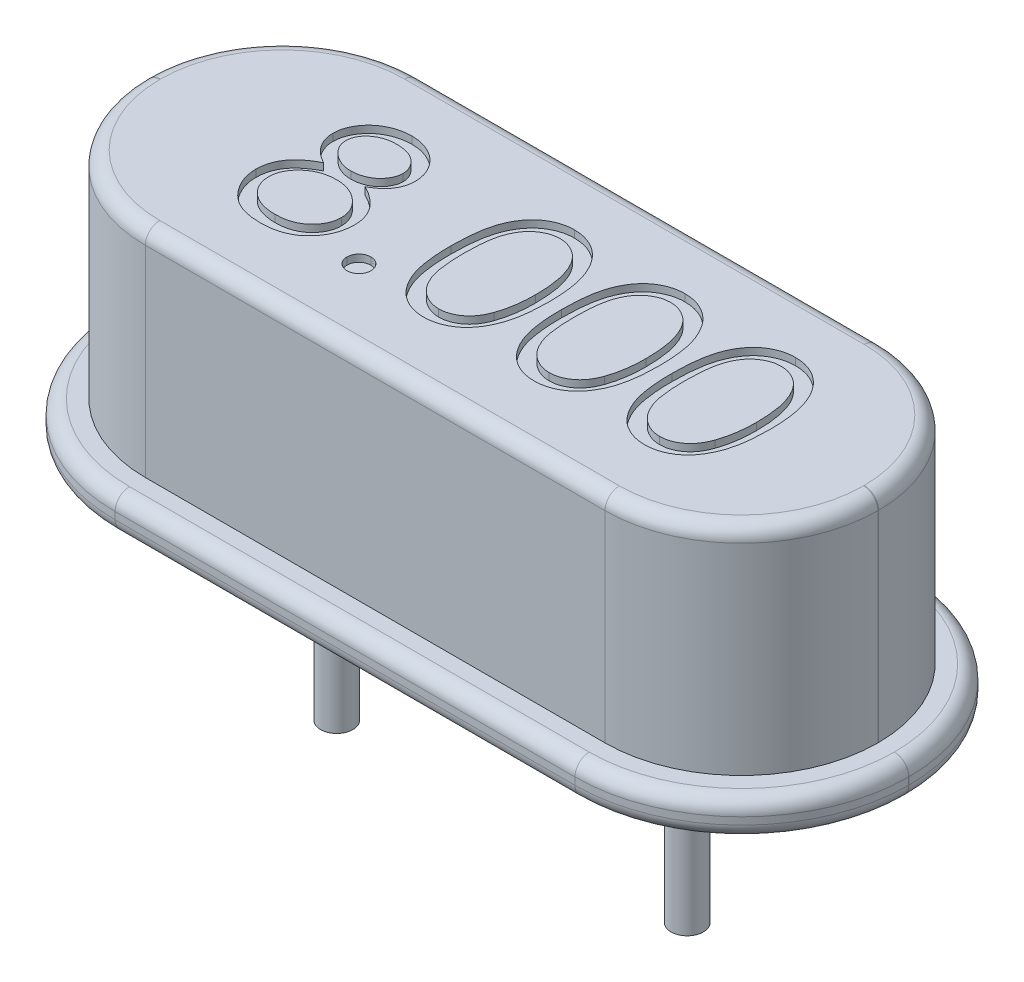
from build123d import *

# Parameters (mm, degrees)
BOSS_EXTRUDE1_DEPTH = 0.5
BOSS_EXTRUDE2_DEPTH = 3
FILLET1_R           = 0.2
SKETCH3_R           = 0.225
BOSS_EXTRUDE3_DEPTH = 3
CUT_EXTRUDE1_DEPTH  = 0.1


with BuildPart() as part:
    # Sketch1 → Boss-Extrude1 (new body)
    with BuildSketch(Plane(origin=(0, 0, 0), x_dir=(1, 0, 0), z_dir=(0, 1, 0))):
        with BuildLine():
            Line((-3.201, -2.325), (3.201, -2.325))
            ThreePointArc((3.201, -2.325), (4.844316159, -1.644316159), (5.525, -0.001))
            Line((5.525, -0.001), (5.525, 0.001))
            ThreePointArc((5.525, 0.001), (4.844316159, 1.644316159), (3.201, 2.325))
            Line((3.201, 2.325), (-3.201, 2.325))
            ThreePointArc((-3.201, 2.325), (-4.844316159, 1.644316159), (-5.525, 0.001))
            Line((-5.525, 0.001), (-5.525, -0.001))
            ThreePointArc((-5.525, -0.001), (-4.844316159, -1.644316159), (-3.201, -2.325))
        make_face()
    extrude(amount=BOSS_EXTRUDE1_DEPTH)

    # Sketch2 → Boss-Extrude2 (add)
    with BuildSketch(Plane(origin=(0, 0.5, 0), x_dir=(1, 0, 0), z_dir=(0, 1, 0))):
        with BuildLine():
            Line((-3.2, -1.905), (3.2, -1.905))
            ThreePointArc((3.2, -1.905), (4.543502884, -1.348502884), (5.1, -0.005))
            Line((5.1, -0.005), (5.1, 0.005))
            ThreePointArc((5.1, 0.005), (4.543502884, 1.348502884), (3.2, 1.905))
            Line((3.2, 1.905), (-3.2, 1.905))
            ThreePointArc((-3.2, 1.905), (-4.543502884, 1.348502884), (-5.1, 0.005))
            Line((-5.1, 0.005), (-5.1, -0.005))
            ThreePointArc((-5.1, -0.005), (-4.543502884, -1.348502884), (-3.2, -1.905))
        make_face()
    extrude(amount=BOSS_EXTRUDE2_DEPTH)

    # Fillet1
    fillet1_edges = [part.edges().sort_by_distance(p)[0] for p in [
        (-4.844316159, 0.5, -1.644316159),
        (0, 0, -2.325),
        (4.844316159, 0, -1.644316159),
        (-5.525, 0.5, 0),
        (-4.844316159, 0.5, 1.644316159),
        (0, 0.5, 2.325),
        (4.844316159, 0.5, 1.644316159),
        (5.525, 0.5, 0),
        (4.543502884, 3.5, -1.348502884),
        (0, 3.5, -1.905),
        (-4.543502884, 3.5, -1.348502884),
        (-5.1, 3.5, 0),
        (-4.543502884, 3.5, 1.348502884),
        (0, 3.5, 1.905),
        (4.543502884, 3.5, 1.348502884),
        (5.1, 3.5, 0),
        (4.844316159, 0.5, -1.644316159),
        (0, 0.5, -2.325),
        (5.525, 0, 0),
        (4.844316159, 0, 1.644316159),
        (0, 0, 2.325),
        (-4.844316159, 0, 1.644316159),
        (-5.525, 0, 0),
        (-4.844316159, 0, -1.644316159),
    ]]
    fillet(fillet1_edges, radius=FILLET1_R)

    # Sketch3 → Boss-Extrude3 (add)
    with BuildSketch(Plane.XZ):
        with Locations(Location((-2.44, 0, 0), (0, 0, 270))):
            Circle(SKETCH3_R)
        with Locations(Location((2.44, 0, 0), (0, 0, 270))):
            Circle(SKETCH3_R)
    extrude(amount=BOSS_EXTRUDE3_DEPTH)

    # Sketch4 → Cut-Extrude1 (cut)
    # profile 1 of 5: a face of its own
    with BuildSketch(Plane(origin=(0, 3.5, 0), x_dir=(1, 0, 0), z_dir=(0, 1, 0))):
        with BuildLine():
            add(Edge.make_bspline(
                [(-2.17690029, 0.131910274), (-2.160529692, 0.123374299), (-2.128601558, 0.106726297), (-2.083128867, 0.07992011), (-2.041571724, 0.05166813), (-2.002777117, 0.023304782), (-1.967426631, -0.006256162), (-1.935915538, -0.037132251), (-1.907465469, -0.068552791), (-1.882650164, -0.101049843), (-1.8608234, -0.134537071), (-1.841959323, -0.16910237), (-1.825835207, -0.204669989), (-1.813056385, -0.241628178), (-1.802529647, -0.279434041), (-1.795286444, -0.318575745), (-1.791391063, -0.358795369), (-1.790654598, -0.385977255), (-1.790281701, -0.399740367)],
                knots=[0, 0, 0, 0, 1.272397273, 2.481599622, 3.635517121, 4.734568067, 5.792894095, 6.808321871, 7.773003508, 8.711915296, 9.623354172, 10.525449501, 11.423591555, 12.311487226, 13.218079475, 14.126165749, 15.051214107, 16, 16, 16, 16], degree=3))
            add(Edge.make_bspline(
                [(-1.790281701, -0.399740367), (-1.790722512, -0.418996215), (-1.791595044, -0.457110761), (-1.799195035, -0.513365682), (-1.81057388, -0.568000986), (-1.827190744, -0.621004695), (-1.848741253, -0.672084337), (-1.875299445, -0.721283636), (-1.905362991, -0.769408956), (-1.929507128, -0.799020042), (-1.941724008, -0.814003188)],
                knots=[0, 0, 0, 0, 1.025265484, 2.029385089, 3.018602448, 3.995076438, 4.983346944, 5.966715145, 6.97116228, 8, 8, 8, 8], degree=3))
            add(Edge.make_bspline(
                [(-1.941724008, -0.814003188), (-1.957630565, -0.831485345), (-1.989247117, -0.866233626), (-2.04340879, -0.911348375), (-2.102849866, -0.949262314), (-2.167340342, -0.98016054), (-2.236707828, -1.004209602), (-2.310937545, -1.021491041), (-2.390174204, -1.031389572), (-2.444634473, -1.032820423), (-2.472573367, -1.03355447)],
                knots=[0, 0, 0, 0, 0.954267603, 1.896743057, 2.838368354, 3.796610408, 4.779680527, 5.799409237, 6.871065594, 8, 8, 8, 8], degree=3))
            add(Edge.make_bspline(
                [(-2.472573367, -1.03355447), (-2.499438161, -1.032895911), (-2.55171432, -1.031614423), (-2.627804536, -1.02293189), (-2.698732004, -1.007715966), (-2.764909129, -0.986890475), (-2.825936954, -0.959798916), (-2.881641583, -0.926079826), (-2.93282671, -0.88709043), (-2.977938981, -0.841710957), (-3.01798952, -0.793106458), (-3.053171265, -0.742962681), (-3.082413595, -0.691275048), (-3.107171935, -0.638814267), (-3.126125091, -0.584845036), (-3.139252069, -0.529645029), (-3.14758882, -0.473310661), (-3.148698039, -0.435292574), (-3.14925606, -0.416166649)],
                knots=[0, 0, 0, 0, 1.256902934, 2.445805442, 3.576955095, 4.645999104, 5.686449165, 6.692658513, 7.68621702, 8.689161843, 9.678783111, 10.630372946, 11.551080876, 12.453998257, 13.34127905, 14.221779781, 15.105423033, 16, 16, 16, 16], degree=3))
            add(Edge.make_bspline(
                [(-3.14925606, -0.416166649), (-3.148925842, -0.402132825), (-3.148273215, -0.374397036), (-3.143756159, -0.333420277), (-3.136494181, -0.293536771), (-3.126631634, -0.254599203), (-3.113265333, -0.216891048), (-3.097126972, -0.180233634), (-3.078308713, -0.144585578), (-3.056548047, -0.109751931), (-3.031232605, -0.076220781), (-3.002567662, -0.04342307), (-2.969980309, -0.011867718), (-2.933833075, 0.018830811), (-2.894539053, 0.049217082), (-2.851077607, 0.077648927), (-2.804600882, 0.106139192), (-2.771569222, 0.123172521), (-2.754624649, 0.131910274)],
                knots=[0, 0, 0, 0, 0.941657376, 1.861047343, 2.762797495, 3.66048619, 4.553285746, 5.444104102, 6.34607688, 7.256116206, 8.197091036, 9.162375105, 10.176350973, 11.237807142, 12.343728897, 13.50695164, 14.721116704, 16, 16, 16, 16], degree=3))
            add(Edge.make_bspline(
                [(-2.754624649, 0.131910274), (-2.777819721, 0.144558713), (-2.822731871, 0.169049631), (-2.882200123, 0.214047806), (-2.933280479, 0.262783701), (-2.974568889, 0.31628644), (-3.007067305, 0.372884654), (-3.029363651, 0.432224227), (-3.044447356, 0.493204863), (-3.045941543, 0.534865547), (-3.046691957, 0.555788479)],
                knots=[0, 0, 0, 0, 1.166880483, 2.259407225, 3.286803203, 4.280235371, 5.237608625, 6.161067461, 7.076446754, 8, 8, 8, 8], degree=3))
            add(Edge.make_bspline(
                [(-3.046691957, 0.555788479), (-3.045757429, 0.577101369), (-3.043878865, 0.619943996), (-3.028688396, 0.683718924), (-3.003934072, 0.746356961), (-2.970264931, 0.807554511), (-2.928329379, 0.865240348), (-2.878017067, 0.916978032), (-2.820529469, 0.962298879), (-2.756153545, 1.000342406), (-2.686875696, 1.031304497), (-2.613780996, 1.052663595), (-2.538143, 1.066627091), (-2.486658589, 1.068208036), (-2.460554136, 1.069009633)],
                knots=[0, 0, 0, 0, 0.888701115, 1.786444228, 2.72001202, 3.692817113, 4.693886446, 5.687152267, 6.695133018, 7.739871481, 8.800368666, 9.853104506, 10.91144658, 12, 12, 12, 12], degree=3))
            add(Edge.make_bspline(
                [(-2.460554136, 1.069009633), (-2.435123385, 1.068183151), (-2.38497684, 1.066553423), (-2.311265625, 1.052960921), (-2.240737123, 1.030258338), (-2.173634552, 0.999459925), (-2.1111592, 0.96152453), (-2.05595788, 0.915581174), (-2.007196405, 0.864071716), (-1.966862465, 0.806403371), (-1.933626528, 0.745440975), (-1.910483156, 0.681656677), (-1.895653457, 0.616428644), (-1.893782963, 0.572292642), (-1.892845803, 0.550179504)],
                knots=[0, 0, 0, 0, 1.072916533, 2.115669174, 3.151510826, 4.193348718, 5.225979165, 6.227137561, 7.216255879, 8.211077061, 9.189680878, 10.138522389, 11.067357538, 12, 12, 12, 12], degree=3))
            add(Edge.make_bspline(
                [(-1.892845803, 0.550179504), (-1.893665552, 0.528478554), (-1.895275492, 0.48585912), (-1.908818315, 0.423729679), (-1.931625923, 0.365545657), (-1.962765444, 0.310646827), (-2.003351437, 0.260028829), (-2.052842142, 0.213047989), (-2.110842987, 0.169318373), (-2.154420636, 0.14464045), (-2.17690029, 0.131910274)],
                knots=[0, 0, 0, 0, 0.975232327, 1.915300861, 2.843280834, 3.77672583, 4.742871857, 5.749627742, 6.839139064, 8, 8, 8, 8], degree=3))
        make_face()
        with BuildLine():
            add(Edge.make_bspline(
                [(-2.470570162, 0.863881428), (-2.484599194, 0.863509176), (-2.512046115, 0.862780889), (-2.55229107, 0.858975953), (-2.590560994, 0.851574115), (-2.627255737, 0.841723423), (-2.661872201, 0.828416001), (-2.694880518, 0.81276171), (-2.725718912, 0.793729672), (-2.754759657, 0.772380416), (-2.780902957, 0.748898756), (-2.804105557, 0.724433774), (-2.823378766, 0.698504978), (-2.839745114, 0.671757344), (-2.851620267, 0.643397015), (-2.860514155, 0.614293485), (-2.866526378, 0.58407898), (-2.866976887, 0.563429546), (-2.867204778, 0.552983992)],
                knots=[0, 0, 0, 0, 1.203892937, 2.355340988, 3.463153438, 4.544400666, 5.610487187, 6.640501085, 7.674077295, 8.714426146, 9.728707835, 10.68524104, 11.601827946, 12.495867327, 13.368432065, 14.231010473, 15.105153427, 16, 16, 16, 16], degree=3))
            add(Edge.make_bspline(
                [(-2.867204778, 0.552983992), (-2.866811996, 0.542537986), (-2.866035805, 0.521895179), (-2.860032874, 0.491411827), (-2.8510861, 0.461456606), (-2.837000008, 0.432741799), (-2.820104946, 0.404271308), (-2.799252674, 0.376756688), (-2.774401801, 0.350102182), (-2.746386121, 0.324534502), (-2.715865242, 0.300592351), (-2.683531503, 0.279807676), (-2.649790708, 0.262416756), (-2.614989525, 0.24794281), (-2.57877327, 0.236691417), (-2.541363856, 0.228709334), (-2.502754998, 0.223748193), (-2.476594666, 0.223155609), (-2.463358624, 0.222855786)],
                knots=[0, 0, 0, 0, 0.873023192, 1.725219244, 2.590779336, 3.480155217, 4.391973325, 5.357036234, 6.360879153, 7.436073238, 8.526419356, 9.601555421, 10.645666583, 11.697338044, 12.750135903, 13.812665442, 14.89329948, 16, 16, 16, 16], degree=3))
            add(Edge.make_bspline(
                [(-2.463358624, 0.222855786), (-2.446358564, 0.223354568), (-2.412526354, 0.224347204), (-2.362652451, 0.233576446), (-2.314159511, 0.248094113), (-2.267565851, 0.267956951), (-2.224077517, 0.292887157), (-2.185311763, 0.322734596), (-2.151599253, 0.35681008), (-2.123290333, 0.394583129), (-2.101341849, 0.434784036), (-2.084255102, 0.475127061), (-2.074277265, 0.516042621), (-2.072975798, 0.543452315), (-2.072332983, 0.556990402)],
                knots=[0, 0, 0, 0, 1.076279235, 2.141928126, 3.20205304, 4.278698113, 5.344010996, 6.36967002, 7.368914609, 8.37248503, 9.349703398, 10.264243087, 11.142681841, 12, 12, 12, 12], degree=3))
            add(Edge.make_bspline(
                [(-2.072332983, 0.556990402), (-2.072636924, 0.566492137), (-2.073240204, 0.585351718), (-2.078211665, 0.613202213), (-2.086426427, 0.640419118), (-2.097548187, 0.667227272), (-2.112182355, 0.693250548), (-2.129533319, 0.718898027), (-2.150610177, 0.743592749), (-2.174265282, 0.767910205), (-2.20109123, 0.790415362), (-2.231036323, 0.810206625), (-2.263947037, 0.827013685), (-2.299824151, 0.840664402), (-2.338535537, 0.850917174), (-2.379902893, 0.858595087), (-2.424271149, 0.862922579), (-2.454802435, 0.863554879), (-2.470570162, 0.863881428)],
                knots=[0, 0, 0, 0, 0.814439003, 1.616544685, 2.417341072, 3.248991801, 4.09997495, 4.973547432, 5.9003056, 6.880240646, 7.880314356, 8.896779544, 9.951930927, 11.043077905, 12.18215768, 13.381699519, 14.647792085, 16, 16, 16, 16], degree=3))
        make_face(mode=Mode.SUBTRACT)
        with BuildLine():
            add(Edge.make_bspline(
                [(-2.458951572, 0.017727581), (-2.476737736, 0.017411215), (-2.511629848, 0.016790581), (-2.562748092, 0.009882295), (-2.611807044, 0.000265499), (-2.658641294, -0.014323552), (-2.703231063, -0.033292975), (-2.745817739, -0.056112712), (-2.786075527, -0.083087251), (-2.823448514, -0.113873888), (-2.857576131, -0.147050719), (-2.887518016, -0.182171939), (-2.912945171, -0.218584815), (-2.933421314, -0.256751803), (-2.950228018, -0.295864724), (-2.96126452, -0.336897635), (-2.968339783, -0.3790617), (-2.969289858, -0.407724613), (-2.96976888, -0.422176265)],
                knots=[0, 0, 0, 0, 1.140299081, 2.23698856, 3.303958914, 4.344563908, 5.37730929, 6.408454204, 7.439741482, 8.480804886, 9.510774543, 10.48932336, 11.43758569, 12.353841022, 13.263987381, 14.161954604, 15.073269652, 16, 16, 16, 16], degree=3))
            add(Edge.make_bspline(
                [(-2.96976888, -0.422176265), (-2.968989875, -0.440136783), (-2.967444347, -0.47577003), (-2.955183411, -0.528434642), (-2.935505962, -0.579418102), (-2.908062981, -0.628304932), (-2.874081511, -0.673990707), (-2.832294958, -0.713812865), (-2.785300194, -0.749196567), (-2.731507134, -0.777814015), (-2.672748011, -0.800668218), (-2.609038452, -0.816414482), (-2.541292784, -0.826838168), (-2.494515874, -0.827888557), (-2.470570162, -0.828426265)],
                knots=[0, 0, 0, 0, 0.898778495, 1.783155532, 2.693654817, 3.627872908, 4.583023416, 5.533784346, 6.509005473, 7.520592997, 8.575161974, 9.658835044, 10.801527049, 12, 12, 12, 12], degree=3))
            add(Edge.make_bspline(
                [(-2.470570162, -0.828426265), (-2.451855666, -0.828066946), (-2.415393827, -0.827366877), (-2.362201856, -0.82118728), (-2.312004971, -0.811387495), (-2.264900515, -0.79713404), (-2.220361178, -0.779734053), (-2.179142118, -0.757350007), (-2.14018296, -0.731891536), (-2.105403461, -0.701686875), (-2.073727342, -0.669412878), (-2.046108318, -0.63524714), (-2.022132574, -0.600118207), (-2.003314885, -0.563232216), (-1.988271312, -0.525296836), (-1.977457852, -0.485962258), (-1.970785729, -0.445107839), (-1.970110931, -0.417394084), (-1.96976888, -0.403346137)],
                knots=[0, 0, 0, 0, 1.224942928, 2.386581632, 3.501229538, 4.569074225, 5.605009692, 6.626002462, 7.634866581, 8.645888296, 9.63523824, 10.59253846, 11.518950513, 12.414518923, 13.29783783, 14.186679152, 15.080837789, 16, 16, 16, 16], degree=3))
            add(Edge.make_bspline(
                [(-1.96976888, -0.403346137), (-1.970286508, -0.389701942), (-1.971307179, -0.362797974), (-1.977785289, -0.322931387), (-1.98916579, -0.284415493), (-2.004781445, -0.246786918), (-2.025570567, -0.210808089), (-2.05005335, -0.175541706), (-2.079592846, -0.141966594), (-2.112971472, -0.109821968), (-2.149348021, -0.08009869), (-2.188014961, -0.053804725), (-2.228674654, -0.031660659), (-2.27124106, -0.013651233), (-2.315619663, 0.000513036), (-2.361777823, 0.01040789), (-2.40976958, 0.016636234), (-2.442372363, 0.017359689), (-2.458951572, 0.017727581)],
                knots=[0, 0, 0, 0, 0.917430815, 1.809013306, 2.70690318, 3.612392954, 4.541220862, 5.495268465, 6.494511384, 7.542276156, 8.608045339, 9.649016899, 10.681629292, 11.715607085, 12.752076957, 13.808767841, 14.885711793, 16, 16, 16, 16], degree=3))
        make_face(mode=Mode.SUBTRACT)
    # profile 2 of 5: a face of its own
    with BuildSketch(Plane(origin=(0, 3.5, 0), x_dir=(1, 0, 0), z_dir=(0, 1, 0))):
        with BuildLine():
            add(Edge.make_bspline(
                [(-1.290281701, -0.674580111), (-1.279144436, -0.67524192), (-1.257311132, -0.676539321), (-1.225745916, -0.685440277), (-1.197177539, -0.701245226), (-1.171730542, -0.722309671), (-1.150755413, -0.74785005), (-1.134387211, -0.776190569), (-1.125563791, -0.80802005), (-1.124275842, -0.829979865), (-1.123615034, -0.841246778)],
                knots=[0, 0, 0, 0, 1.020151414, 1.999887582, 2.974338812, 3.990962822, 5.007586832, 5.987933904, 6.967670073, 8, 8, 8, 8], degree=3))
            add(Edge.make_bspline(
                [(-1.123615034, -0.841246778), (-1.124298234, -0.852242966), (-1.125645496, -0.873927288), (-1.134366986, -0.905516695), (-1.150880157, -0.933874927), (-1.171585868, -0.959761863), (-1.19718383, -0.980870931), (-1.225813456, -0.996541414), (-1.257237032, -1.006079688), (-1.279132074, -1.007294715), (-1.290281701, -1.007913444)],
                knots=[0, 0, 0, 0, 1.009421747, 1.99056486, 2.972319754, 3.999869655, 5.017953583, 5.993804169, 6.978383603, 8, 8, 8, 8], degree=3))
            add(Edge.make_bspline(
                [(-1.290281701, -1.007913444), (-1.301439361, -1.007317103), (-1.323222037, -1.006152889), (-1.354528319, -0.996345571), (-1.383332301, -0.981017879), (-1.408925279, -0.959722502), (-1.429804406, -0.934008135), (-1.445590339, -0.905321394), (-1.455070424, -0.874017715), (-1.456317209, -0.852260777), (-1.456948367, -0.841246778)],
                knots=[0, 0, 0, 0, 1.022052826, 1.995314843, 2.982371812, 4.00089066, 5.028879526, 6.005146991, 6.990147033, 8, 8, 8, 8], degree=3))
            add(Edge.make_bspline(
                [(-1.456948367, -0.841246778), (-1.456341453, -0.829961418), (-1.455156529, -0.807928138), (-1.445570437, -0.776385791), (-1.429926887, -0.747718111), (-1.408780947, -0.722348637), (-1.383338493, -0.70109875), (-1.354597804, -0.685633153), (-1.323146638, -0.676467204), (-1.301426673, -0.675220051), (-1.290281701, -0.674580111)],
                knots=[0, 0, 0, 0, 1.032775665, 2.016367738, 2.991239715, 4.008302682, 5.025365648, 6.011011707, 6.979408107, 8, 8, 8, 8], degree=3))
        make_face()
    # profile 3 of 5: a face of its own
    with BuildSketch(Plane(origin=(0, 3.5, 0), x_dir=(1, 0, 0), z_dir=(0, 1, 0))):
        with BuildLine():
            add(Edge.make_bspline(
                [(-0.867204778, 0.016926299), (-0.867017339, 0.048981949), (-0.866653236, 0.111250512), (-0.862602709, 0.201984593), (-0.855873942, 0.287104758), (-0.846652587, 0.366615082), (-0.835430884, 0.44053609), (-0.820450605, 0.508670237), (-0.803414718, 0.571332869), (-0.783670464, 0.628728325), (-0.761391727, 0.68162987), (-0.737143578, 0.731015699), (-0.709963695, 0.776811089), (-0.681405459, 0.81974697), (-0.650312847, 0.859120509), (-0.617570681, 0.895487745), (-0.581901038, 0.928008174), (-0.544516461, 0.957634632), (-0.505078482, 0.983605759), (-0.464711244, 1.00648161), (-0.423136898, 1.026024391), (-0.380241936, 1.041390354), (-0.336411903, 1.054082267), (-0.291493579, 1.062761666), (-0.2454128, 1.068222756), (-0.214309123, 1.068744852), (-0.198534906, 1.069009633)],
                knots=[0, 0, 0, 0, 1.646270934, 3.197905019, 4.663502075, 6.030701355, 7.308322542, 8.50163776, 9.611534131, 10.641858119, 11.616356847, 12.558055219, 13.465016945, 14.349605745, 15.204443733, 16.039544428, 16.859896111, 17.680448484, 18.487036065, 19.28249412, 20.06191084, 20.843045899, 21.620316918, 22.403196591, 23.190181807, 24, 24, 24, 24], degree=3))
            add(Edge.make_bspline(
                [(-0.198534906, 1.069009633), (-0.182628918, 1.068730881), (-0.150996913, 1.068176532), (-0.104230984, 1.062848565), (-0.058545452, 1.054007923), (-0.014135087, 1.041481652), (0.029364905, 1.025941265), (0.071614281, 1.006462913), (0.112875471, 0.983789274), (0.152492778, 0.957147059), (0.19090113, 0.927442901), (0.227157108, 0.893864233), (0.261264015, 0.856750107), (0.293649903, 0.816497614), (0.323395959, 0.772334708), (0.351723634, 0.725029503), (0.377079084, 0.673754723), (0.401498898, 0.619365884), (0.422577176, 0.560358079), (0.441586459, 0.49706393), (0.45694587, 0.428735823), (0.46973974, 0.355732255), (0.479651109, 0.277785121), (0.486869761, 0.195061512), (0.490682953, 0.107507003), (0.491401068, 0.047645375), (0.491769581, 0.016926299)],
                knots=[0, 0, 0, 0, 0.810914788, 1.612654377, 2.396697861, 3.181598691, 3.963628158, 4.749916497, 5.551656086, 6.361998678, 7.18212741, 8.025565596, 8.878627764, 9.750805457, 10.657531673, 11.591944965, 12.560506719, 13.57287815, 14.630710178, 15.753379473, 16.941251878, 18.199788006, 19.531962791, 20.947069417, 22.433333509, 24, 24, 24, 24], degree=3))
            add(Edge.make_bspline(
                [(0.491769581, 0.016926299), (0.491397247, -0.013658791), (0.49067177, -0.073252592), (0.486912509, -0.160413149), (0.479507577, -0.242697746), (0.470244726, -0.320303724), (0.457415605, -0.392908078), (0.441641224, -0.460762048), (0.424126754, -0.524158661), (0.402506871, -0.582578553), (0.378843608, -0.63683668), (0.353097782, -0.687503622), (0.325515024, -0.735027218), (0.295464313, -0.779027073), (0.263433791, -0.819814877), (0.228737911, -0.856670662), (0.19235472, -0.890482474), (0.15383334, -0.920569119), (0.113598167, -0.946903293), (0.072478695, -0.970454064), (0.029745333, -0.989444176), (-0.013633497, -1.005749914), (-0.058278278, -1.018207315), (-0.104133358, -1.026820946), (-0.150965493, -1.032862003), (-0.18262353, -1.033322848), (-0.198534906, -1.03355447)],
                knots=[0, 0, 0, 0, 1.561518951, 3.042555995, 4.452378317, 5.7783523, 7.031515105, 8.214008947, 9.334062868, 10.386615937, 11.391082383, 12.354592575, 13.286541444, 14.194233754, 15.072674879, 15.931287219, 16.775624067, 17.606195743, 18.42308326, 19.229000347, 20.022332153, 20.807536673, 21.593273796, 22.3848459, 23.188221202, 24, 24, 24, 24], degree=3))
            add(Edge.make_bspline(
                [(-0.198534906, -1.03355447), (-0.214308685, -1.033287981), (-0.245411499, -1.032762517), (-0.2914986, -1.027326099), (-0.336231424, -1.018585812), (-0.379830712, -1.006347752), (-0.42252015, -0.991367846), (-0.463718028, -0.971851455), (-0.503882418, -0.949374844), (-0.542906165, -0.923777461), (-0.580055971, -0.894450784), (-0.615540888, -0.862014048), (-0.648469471, -0.825657813), (-0.679117525, -0.785956143), (-0.708245576, -0.74327429), (-0.735039503, -0.697029505), (-0.759822848, -0.647405156), (-0.782476272, -0.594080636), (-0.802561222, -0.53627782), (-0.82030277, -0.473335432), (-0.83431086, -0.404697926), (-0.84630112, -0.330916573), (-0.855972196, -0.251674328), (-0.862574668, -0.166928169), (-0.866655419, -0.076730906), (-0.867018316, -0.014862464), (-0.867204778, 0.016926299)],
                knots=[0, 0, 0, 0, 0.810891512, 1.598919785, 2.382837074, 3.152667961, 3.926044502, 4.706494248, 5.493654104, 6.291793342, 7.103789334, 7.925228297, 8.761435821, 9.622817696, 10.50288917, 11.416980706, 12.369136599, 13.353924996, 14.394355917, 15.514179734, 16.714354668, 17.994756427, 19.357759367, 20.818452758, 22.365282078, 24, 24, 24, 24], degree=3))
        make_face()
        with BuildLine():
            add(Edge.make_bspline(
                [(-0.687717598, 0.017727581), (-0.687649343, -0.008985961), (-0.687516872, -0.060831701), (-0.684056186, -0.136170707), (-0.679341768, -0.206439466), (-0.673261027, -0.271727201), (-0.66423077, -0.331812923), (-0.654112606, -0.387109885), (-0.641799412, -0.437325449), (-0.62723083, -0.482804198), (-0.61063706, -0.524317951), (-0.592519424, -0.562947217), (-0.573056154, -0.599148323), (-0.551273782, -0.6325961), (-0.527550889, -0.663399622), (-0.502423312, -0.692104098), (-0.474953264, -0.717702373), (-0.436951125, -0.748403433), (-0.386781711, -0.780128652), (-0.323570023, -0.807754989), (-0.258616622, -0.825116393), (-0.214530194, -0.827324253), (-0.19252529, -0.828426265)],
                knots=[0, 0, 0, 0, 1.459021318, 2.831673884, 4.118529203, 5.306027144, 6.411944654, 7.436330062, 8.375795394, 9.233974572, 10.042671642, 10.816086306, 11.563610507, 12.285937304, 12.993564865, 13.685989202, 14.367179055, 15.041617293, 16.353048772, 17.594441528, 18.799311195, 20, 20, 20, 20], degree=3))
            add(Edge.make_bspline(
                [(-0.19252529, -0.828426265), (-0.170378049, -0.827513247), (-0.126129293, -0.825689097), (-0.06148141, -0.808089819), (0.001278744, -0.781535796), (0.05046271, -0.750137221), (0.087881306, -0.720235319), (0.114691015, -0.694741234), (0.1392979, -0.666195024), (0.162636228, -0.635395427), (0.184041414, -0.601754007), (0.203506064, -0.565432535), (0.221267977, -0.526330148), (0.231387432, -0.499033154), (0.236561248, -0.485076906)],
                knots=[0, 0, 0, 0, 1.353760809, 2.704726607, 4.075137775, 5.516104923, 6.260822281, 7.007110065, 7.778089737, 8.566572457, 9.372053459, 10.217411131, 11.088608312, 12, 12, 12, 12], degree=3))
            add(Edge.make_bspline(
                [(0.236561248, -0.485076906), (0.24259083, -0.46723134), (0.254833466, -0.430997189), (0.270611623, -0.374789388), (0.283037565, -0.31581638), (0.294216631, -0.254430599), (0.301846949, -0.190179342), (0.307988557, -0.123261408), (0.311606092, -0.053626344), (0.312054521, -0.00631492), (0.312282402, 0.017727581)],
                knots=[0, 0, 0, 0, 0.884706709, 1.796334032, 2.740027952, 3.714592787, 4.726048262, 5.777819803, 6.87074269, 8, 8, 8, 8], degree=3))
            add(Edge.make_bspline(
                [(0.312282402, 0.017727581), (0.311968008, 0.041766194), (0.311352987, 0.08879086), (0.309002136, 0.157658392), (0.302931522, 0.223068541), (0.296189169, 0.285303097), (0.2862479, 0.344017555), (0.275529153, 0.399703444), (0.26112846, 0.451670887), (0.245745732, 0.500733505), (0.228139791, 0.546333879), (0.208759372, 0.588684614), (0.188061224, 0.627990171), (0.165579944, 0.664142709), (0.14158241, 0.697304162), (0.115435239, 0.726809645), (0.088175598, 0.753573626), (0.049994349, 0.784123666), (9.04e-06, 0.815273206), (-0.062188473, 0.843939355), (-0.126914555, 0.860401236), (-0.170670814, 0.8627222), (-0.19252529, 0.863881428)],
                knots=[0, 0, 0, 0, 1.31362396, 2.569729283, 3.763502607, 4.902122613, 5.988968491, 7.01645872, 7.998833611, 8.933434873, 9.825090667, 10.667526885, 11.477055099, 12.250526234, 12.991942729, 13.710640831, 14.402115721, 15.076753259, 16.378508321, 17.609869233, 18.806226677, 20, 20, 20, 20], degree=3))
            add(Edge.make_bspline(
                [(-0.19252529, 0.863881428), (-0.214645629, 0.862720601), (-0.258926603, 0.860396833), (-0.324325435, 0.844000688), (-0.387013636, 0.81542185), (-0.436866764, 0.784020495), (-0.475074642, 0.754112888), (-0.501979038, 0.728177771), (-0.527205422, 0.699808483), (-0.550444108, 0.668721675), (-0.572209413, 0.635312893), (-0.592198563, 0.599319314), (-0.610208465, 0.560558534), (-0.6268282, 0.519063428), (-0.641441222, 0.473588603), (-0.653494915, 0.423434892), (-0.664630374, 0.368313811), (-0.672513385, 0.307902664), (-0.679521246, 0.242598576), (-0.684024873, 0.172154394), (-0.687528449, 0.096689034), (-0.687653285, 0.044575229), (-0.687717598, 0.017727581)],
                knots=[0, 0, 0, 0, 1.207732386, 2.417664972, 3.655092373, 4.956220595, 5.625982001, 6.301752483, 6.994047911, 7.697131622, 8.419323945, 9.170223765, 9.943494443, 10.752040957, 11.610060368, 12.549350801, 13.567764191, 14.679664412, 15.874934091, 17.154273443, 18.533957287, 20, 20, 20, 20], degree=3))
        make_face(mode=Mode.SUBTRACT)
    # profile 4 of 5: a face of its own
    with BuildSketch(Plane(origin=(0, 3.5, 0), x_dir=(1, 0, 0), z_dir=(0, 1, 0))):
        with BuildLine():
            add(Edge.make_bspline(
                [(0.671256761, 0.016926299), (0.6714442, 0.048981949), (0.671808303, 0.111250512), (0.675858829, 0.201984593), (0.682587596, 0.287104758), (0.691808952, 0.366615082), (0.703030655, 0.44053609), (0.718010933, 0.508670237), (0.73504682, 0.571332869), (0.754791075, 0.628728325), (0.777069812, 0.68162987), (0.801317961, 0.731015699), (0.828497843, 0.776811089), (0.857056079, 0.81974697), (0.888148691, 0.859120509), (0.920890857, 0.895487745), (0.956560501, 0.928008174), (0.993945077, 0.957634632), (1.033383057, 0.983605759), (1.073750295, 1.00648161), (1.115324641, 1.026024391), (1.158219602, 1.041390354), (1.202049635, 1.054082267), (1.246967959, 1.062761666), (1.293048739, 1.068222756), (1.324152416, 1.068744852), (1.339926633, 1.069009633)],
                knots=[0, 0, 0, 0, 1.646270934, 3.197905019, 4.663502075, 6.030701355, 7.308322542, 8.50163776, 9.611534131, 10.641858119, 11.616356847, 12.558055219, 13.465016945, 14.349605745, 15.204443733, 16.039544428, 16.859896111, 17.680448484, 18.487036065, 19.28249412, 20.06191084, 20.843045899, 21.620316918, 22.403196591, 23.190181807, 24, 24, 24, 24], degree=3))
            add(Edge.make_bspline(
                [(1.339926633, 1.069009633), (1.35583262, 1.068730881), (1.387464626, 1.068176532), (1.434230554, 1.062848565), (1.479916087, 1.054007923), (1.524326452, 1.041481652), (1.567826444, 1.025941265), (1.61007582, 1.006462913), (1.651337009, 0.983789274), (1.690954316, 0.957147059), (1.729362668, 0.927442901), (1.765618647, 0.893864233), (1.799725553, 0.856750107), (1.832111442, 0.816497614), (1.861857497, 0.772334708), (1.890185173, 0.725029503), (1.915540622, 0.673754723), (1.939960436, 0.619365884), (1.961038715, 0.560358079), (1.980047998, 0.49706393), (1.995407408, 0.428735823), (2.008201278, 0.355732255), (2.018112647, 0.277785121), (2.0253313, 0.195061512), (2.029144491, 0.107507003), (2.029862606, 0.047645375), (2.03023112, 0.016926299)],
                knots=[0, 0, 0, 0, 0.810914788, 1.612654377, 2.396697861, 3.181598691, 3.963628158, 4.749916497, 5.551656086, 6.361998678, 7.18212741, 8.025565596, 8.878627764, 9.750805457, 10.657531673, 11.591944965, 12.560506719, 13.57287815, 14.630710178, 15.753379473, 16.941251878, 18.199788006, 19.531962791, 20.947069417, 22.433333509, 24, 24, 24, 24], degree=3))
            add(Edge.make_bspline(
                [(2.03023112, 0.016926299), (2.029858786, -0.013658791), (2.029133308, -0.073252592), (2.025374047, -0.160413149), (2.017969115, -0.242697746), (2.008706265, -0.320303724), (1.995877143, -0.392908078), (1.980102762, -0.460762048), (1.962588292, -0.524158661), (1.94096841, -0.582578553), (1.917305147, -0.63683668), (1.89155932, -0.687503622), (1.863976563, -0.735027218), (1.833925851, -0.779027073), (1.801895329, -0.819814877), (1.76719945, -0.856670662), (1.730816258, -0.890482474), (1.692294878, -0.920569119), (1.652059706, -0.946903293), (1.610940233, -0.970454064), (1.568206871, -0.989444176), (1.524828041, -1.005749914), (1.480183261, -1.018207315), (1.43432818, -1.026820946), (1.387496045, -1.032862003), (1.355838008, -1.033322848), (1.339926633, -1.03355447)],
                knots=[0, 0, 0, 0, 1.561518951, 3.042555995, 4.452378317, 5.7783523, 7.031515105, 8.214008947, 9.334062868, 10.386615937, 11.391082383, 12.354592575, 13.286541444, 14.194233754, 15.072674879, 15.931287219, 16.775624067, 17.606195743, 18.42308326, 19.229000347, 20.022332153, 20.807536673, 21.593273796, 22.3848459, 23.188221202, 24, 24, 24, 24], degree=3))
            add(Edge.make_bspline(
                [(1.339926633, -1.03355447), (1.324152853, -1.033287981), (1.293050039, -1.032762517), (1.246962939, -1.027326099), (1.202230114, -1.018585812), (1.158630826, -1.006347752), (1.115941389, -0.991367846), (1.074743511, -0.971851455), (1.03457912, -0.949374844), (0.995555374, -0.923777461), (0.958405568, -0.894450784), (0.92292065, -0.862014048), (0.889992068, -0.825657813), (0.859344013, -0.785956143), (0.830215963, -0.74327429), (0.803422035, -0.697029505), (0.77863869, -0.647405156), (0.755985267, -0.594080636), (0.735900316, -0.53627782), (0.718158769, -0.473335432), (0.704150679, -0.404697926), (0.692160419, -0.330916573), (0.682489343, -0.251674328), (0.675886871, -0.166928169), (0.671806119, -0.076730906), (0.671443222, -0.014862464), (0.671256761, 0.016926299)],
                knots=[0, 0, 0, 0, 0.810891512, 1.598919785, 2.382837074, 3.152667961, 3.926044502, 4.706494248, 5.493654104, 6.291793342, 7.103789334, 7.925228297, 8.761435821, 9.622817696, 10.50288917, 11.416980706, 12.369136599, 13.353924996, 14.394355917, 15.514179734, 16.714354668, 17.994756427, 19.357759367, 20.818452758, 22.365282078, 24, 24, 24, 24], degree=3))
        make_face()
        with BuildLine():
            add(Edge.make_bspline(
                [(0.85074394, 0.017727581), (0.850812196, -0.008985961), (0.850944666, -0.060831701), (0.854405352, -0.136170707), (0.859119771, -0.206439466), (0.865200512, -0.271727201), (0.874230768, -0.331812923), (0.884348933, -0.387109885), (0.896662127, -0.437325449), (0.911230708, -0.482804198), (0.927824478, -0.524317951), (0.945942114, -0.562947217), (0.965405385, -0.599148323), (0.987187756, -0.6325961), (1.01091065, -0.663399622), (1.036038226, -0.692104098), (1.063508274, -0.717702373), (1.101510413, -0.748403433), (1.151679827, -0.780128652), (1.214891516, -0.807754989), (1.279844916, -0.825116393), (1.323931345, -0.827324253), (1.345936248, -0.828426265)],
                knots=[0, 0, 0, 0, 1.459021318, 2.831673884, 4.118529203, 5.306027144, 6.411944654, 7.436330062, 8.375795394, 9.233974572, 10.042671642, 10.816086306, 11.563610507, 12.285937304, 12.993564865, 13.685989202, 14.367179055, 15.041617293, 16.353048772, 17.594441528, 18.799311195, 20, 20, 20, 20], degree=3))
            add(Edge.make_bspline(
                [(1.345936248, -0.828426265), (1.368083489, -0.827513247), (1.412332245, -0.825689097), (1.476980128, -0.808089819), (1.539740282, -0.781535796), (1.588924248, -0.750137221), (1.626342845, -0.720235319), (1.653152553, -0.694741234), (1.677759438, -0.666195024), (1.701097767, -0.635395427), (1.722502953, -0.601754007), (1.741967603, -0.565432535), (1.759729516, -0.526330148), (1.76984897, -0.499033154), (1.775022787, -0.485076906)],
                knots=[0, 0, 0, 0, 1.353760809, 2.704726607, 4.075137775, 5.516104923, 6.260822281, 7.007110065, 7.778089737, 8.566572457, 9.372053459, 10.217411131, 11.088608312, 12, 12, 12, 12], degree=3))
            add(Edge.make_bspline(
                [(1.775022787, -0.485076906), (1.781052368, -0.46723134), (1.793295005, -0.430997189), (1.809073161, -0.374789388), (1.821499104, -0.31581638), (1.83267817, -0.254430599), (1.840308488, -0.190179342), (1.846450095, -0.123261408), (1.850067631, -0.053626344), (1.85051606, -0.00631492), (1.85074394, 0.017727581)],
                knots=[0, 0, 0, 0, 0.884706709, 1.796334032, 2.740027952, 3.714592787, 4.726048262, 5.777819803, 6.87074269, 8, 8, 8, 8], degree=3))
            add(Edge.make_bspline(
                [(1.85074394, 0.017727581), (1.850429547, 0.041766194), (1.849814525, 0.08879086), (1.847463675, 0.157658392), (1.841393061, 0.223068541), (1.834650707, 0.285303097), (1.824709438, 0.344017555), (1.813990691, 0.399703444), (1.799589999, 0.451670887), (1.78420727, 0.500733505), (1.76660133, 0.546333879), (1.74722091, 0.588684614), (1.726522762, 0.627990171), (1.704041482, 0.664142709), (1.680043949, 0.697304162), (1.653896778, 0.726809645), (1.626637136, 0.753573626), (1.588455887, 0.784123666), (1.538470579, 0.815273206), (1.476273066, 0.843939355), (1.411546984, 0.860401236), (1.367790724, 0.8627222), (1.345936248, 0.863881428)],
                knots=[0, 0, 0, 0, 1.31362396, 2.569729283, 3.763502607, 4.902122613, 5.988968491, 7.01645872, 7.998833611, 8.933434873, 9.825090667, 10.667526885, 11.477055099, 12.250526234, 12.991942729, 13.710640831, 14.402115721, 15.076753259, 16.378508321, 17.609869233, 18.806226677, 20, 20, 20, 20], degree=3))
            add(Edge.make_bspline(
                [(1.345936248, 0.863881428), (1.32381591, 0.862720601), (1.279534935, 0.860396833), (1.214136104, 0.844000688), (1.151447903, 0.81542185), (1.101594775, 0.784020495), (1.063386897, 0.754112888), (1.0364825, 0.728177771), (1.011256116, 0.699808483), (0.98801743, 0.668721675), (0.966252126, 0.635312893), (0.946262976, 0.599319314), (0.928253073, 0.560558534), (0.911633338, 0.519063428), (0.897020316, 0.473588603), (0.884966623, 0.423434892), (0.873831164, 0.368313811), (0.865948153, 0.307902664), (0.858940293, 0.242598576), (0.854436666, 0.172154394), (0.85093309, 0.096689034), (0.850808253, 0.044575229), (0.85074394, 0.017727581)],
                knots=[0, 0, 0, 0, 1.207732386, 2.417664972, 3.655092373, 4.956220595, 5.625982001, 6.301752483, 6.994047911, 7.697131622, 8.419323945, 9.170223765, 9.943494443, 10.752040957, 11.610060368, 12.549350801, 13.567764191, 14.679664412, 15.874934091, 17.154273443, 18.533957287, 20, 20, 20, 20], degree=3))
        make_face(mode=Mode.SUBTRACT)
    # profile 5 of 5: a face of its own
    with BuildSketch(Plane(origin=(0, 3.5, 0), x_dir=(1, 0, 0), z_dir=(0, 1, 0))):
        with BuildLine():
            add(Edge.make_bspline(
                [(2.209718299, 0.016926299), (2.209905738, 0.048981949), (2.210269841, 0.111250512), (2.214320367, 0.201984593), (2.221049135, 0.287104758), (2.23027049, 0.366615082), (2.241492193, 0.44053609), (2.256472471, 0.508670237), (2.273508359, 0.571332869), (2.293252613, 0.628728325), (2.31553135, 0.68162987), (2.339779499, 0.731015699), (2.366959382, 0.776811089), (2.395517617, 0.81974697), (2.42661023, 0.859120509), (2.459352396, 0.895487745), (2.495022039, 0.928008174), (2.532406616, 0.957634632), (2.571844595, 0.983605759), (2.612211833, 1.00648161), (2.653786179, 1.026024391), (2.696681141, 1.041390354), (2.740511174, 1.054082267), (2.785429498, 1.062761666), (2.831510277, 1.068222756), (2.862613954, 1.068744852), (2.878388171, 1.069009633)],
                knots=[0, 0, 0, 0, 1.646270934, 3.197905019, 4.663502075, 6.030701355, 7.308322542, 8.50163776, 9.611534131, 10.641858119, 11.616356847, 12.558055219, 13.465016945, 14.349605745, 15.204443733, 16.039544428, 16.859896111, 17.680448484, 18.487036065, 19.28249412, 20.06191084, 20.843045899, 21.620316918, 22.403196591, 23.190181807, 24, 24, 24, 24], degree=3))
            add(Edge.make_bspline(
                [(2.878388171, 1.069009633), (2.894294159, 1.068730881), (2.925926164, 1.068176532), (2.972692093, 1.062848565), (3.018377625, 1.054007923), (3.06278799, 1.041481652), (3.106287982, 1.025941265), (3.148537358, 1.006462913), (3.189798548, 0.983789274), (3.229415855, 0.957147059), (3.267824206, 0.927442901), (3.304080185, 0.893864233), (3.338187092, 0.856750107), (3.37057298, 0.816497614), (3.400319036, 0.772334708), (3.428646711, 0.725029503), (3.45400216, 0.673754723), (3.478421975, 0.619365884), (3.499500253, 0.560358079), (3.518509536, 0.49706393), (3.533868947, 0.428735823), (3.546662817, 0.355732255), (3.556574186, 0.277785121), (3.563792838, 0.195061512), (3.56760603, 0.107507003), (3.568324145, 0.047645375), (3.568692658, 0.016926299)],
                knots=[0, 0, 0, 0, 0.810914788, 1.612654377, 2.396697861, 3.181598691, 3.963628158, 4.749916497, 5.551656086, 6.361998678, 7.18212741, 8.025565596, 8.878627764, 9.750805457, 10.657531673, 11.591944965, 12.560506719, 13.57287815, 14.630710178, 15.753379473, 16.941251878, 18.199788006, 19.531962791, 20.947069417, 22.433333509, 24, 24, 24, 24], degree=3))
            add(Edge.make_bspline(
                [(3.568692658, 0.016926299), (3.568320324, -0.013658791), (3.567594847, -0.073252592), (3.563835586, -0.160413149), (3.556430654, -0.242697746), (3.547167803, -0.320303724), (3.534338681, -0.392908078), (3.518564301, -0.460762048), (3.501049831, -0.524158661), (3.479429948, -0.582578553), (3.455766685, -0.63683668), (3.430020859, -0.687503622), (3.402438101, -0.735027218), (3.37238739, -0.779027073), (3.340356868, -0.819814877), (3.305660988, -0.856670662), (3.269277797, -0.890482474), (3.230756416, -0.920569119), (3.190521244, -0.946903293), (3.149401772, -0.970454064), (3.10666841, -0.989444176), (3.06328958, -1.005749914), (3.018644799, -1.018207315), (2.972789719, -1.026820946), (2.925957584, -1.032862003), (2.894299547, -1.033322848), (2.878388171, -1.03355447)],
                knots=[0, 0, 0, 0, 1.561518951, 3.042555995, 4.452378317, 5.7783523, 7.031515105, 8.214008947, 9.334062868, 10.386615937, 11.391082383, 12.354592575, 13.286541444, 14.194233754, 15.072674879, 15.931287219, 16.775624067, 17.606195743, 18.42308326, 19.229000347, 20.022332153, 20.807536673, 21.593273796, 22.3848459, 23.188221202, 24, 24, 24, 24], degree=3))
            add(Edge.make_bspline(
                [(2.878388171, -1.03355447), (2.862614392, -1.033287981), (2.831511578, -1.032762517), (2.785424477, -1.027326099), (2.740691653, -1.018585812), (2.697092365, -1.006347752), (2.654402927, -0.991367846), (2.613205049, -0.971851455), (2.573040659, -0.949374844), (2.534016912, -0.923777461), (2.496867106, -0.894450784), (2.461382189, -0.862014048), (2.428453606, -0.825657813), (2.397805552, -0.785956143), (2.368677501, -0.74327429), (2.341883574, -0.697029505), (2.317100228, -0.647405156), (2.294446805, -0.594080636), (2.274361855, -0.53627782), (2.256620307, -0.473335432), (2.242612217, -0.404697926), (2.230621957, -0.330916573), (2.220950881, -0.251674328), (2.214348409, -0.166928169), (2.210267658, -0.076730906), (2.209904761, -0.014862464), (2.209718299, 0.016926299)],
                knots=[0, 0, 0, 0, 0.810891512, 1.598919785, 2.382837074, 3.152667961, 3.926044502, 4.706494248, 5.493654104, 6.291793342, 7.103789334, 7.925228297, 8.761435821, 9.622817696, 10.50288917, 11.416980706, 12.369136599, 13.353924996, 14.394355917, 15.514179734, 16.714354668, 17.994756427, 19.357759367, 20.818452758, 22.365282078, 24, 24, 24, 24], degree=3))
        make_face()
        with BuildLine():
            add(Edge.make_bspline(
                [(2.389205479, 0.017727581), (2.389273734, -0.008985961), (2.389406205, -0.060831701), (2.392866891, -0.136170707), (2.397581309, -0.206439466), (2.40366205, -0.271727201), (2.412692307, -0.331812923), (2.422810471, -0.387109885), (2.435123665, -0.437325449), (2.449692247, -0.482804198), (2.466286017, -0.524317951), (2.484403653, -0.562947217), (2.503866923, -0.599148323), (2.525649295, -0.6325961), (2.549372188, -0.663399622), (2.574499765, -0.692104098), (2.601969813, -0.717702373), (2.639971952, -0.748403433), (2.690141366, -0.780128652), (2.753353054, -0.807754989), (2.818306455, -0.825116393), (2.862392883, -0.827324253), (2.884397787, -0.828426265)],
                knots=[0, 0, 0, 0, 1.459021318, 2.831673884, 4.118529203, 5.306027144, 6.411944654, 7.436330062, 8.375795394, 9.233974572, 10.042671642, 10.816086306, 11.563610507, 12.285937304, 12.993564865, 13.685989202, 14.367179055, 15.041617293, 16.353048772, 17.594441528, 18.799311195, 20, 20, 20, 20], degree=3))
            add(Edge.make_bspline(
                [(2.884397787, -0.828426265), (2.906545028, -0.827513247), (2.950793784, -0.825689097), (3.015441667, -0.808089819), (3.078201821, -0.781535796), (3.127385787, -0.750137221), (3.164804383, -0.720235319), (3.191614092, -0.694741234), (3.216220977, -0.666195024), (3.239559305, -0.635395427), (3.260964491, -0.601754007), (3.280429141, -0.565432535), (3.298191054, -0.526330148), (3.308310509, -0.499033154), (3.313484325, -0.485076906)],
                knots=[0, 0, 0, 0, 1.353760809, 2.704726607, 4.075137775, 5.516104923, 6.260822281, 7.007110065, 7.778089737, 8.566572457, 9.372053459, 10.217411131, 11.088608312, 12, 12, 12, 12], degree=3))
            add(Edge.make_bspline(
                [(3.313484325, -0.485076906), (3.319513907, -0.46723134), (3.331756543, -0.430997189), (3.3475347, -0.374789388), (3.359960642, -0.31581638), (3.371139708, -0.254430599), (3.378770026, -0.190179342), (3.384911634, -0.123261408), (3.388529169, -0.053626344), (3.388977598, -0.00631492), (3.389205479, 0.017727581)],
                knots=[0, 0, 0, 0, 0.884706709, 1.796334032, 2.740027952, 3.714592787, 4.726048262, 5.777819803, 6.87074269, 8, 8, 8, 8], degree=3))
            add(Edge.make_bspline(
                [(3.389205479, 0.017727581), (3.388891085, 0.041766194), (3.388276063, 0.08879086), (3.385925213, 0.157658392), (3.379854599, 0.223068541), (3.373112246, 0.285303097), (3.363170977, 0.344017555), (3.35245223, 0.399703444), (3.338051537, 0.451670887), (3.322668808, 0.500733505), (3.305062868, 0.546333879), (3.285682449, 0.588684614), (3.264984301, 0.627990171), (3.24250302, 0.664142709), (3.218505487, 0.697304162), (3.192358316, 0.726809645), (3.165098675, 0.753573626), (3.126917426, 0.784123666), (3.076932117, 0.815273206), (3.014734604, 0.843939355), (2.950008522, 0.860401236), (2.906252263, 0.8627222), (2.884397787, 0.863881428)],
                knots=[0, 0, 0, 0, 1.31362396, 2.569729283, 3.763502607, 4.902122613, 5.988968491, 7.01645872, 7.998833611, 8.933434873, 9.825090667, 10.667526885, 11.477055099, 12.250526234, 12.991942729, 13.710640831, 14.402115721, 15.076753259, 16.378508321, 17.609869233, 18.806226677, 20, 20, 20, 20], degree=3))
            add(Edge.make_bspline(
                [(2.884397787, 0.863881428), (2.862277448, 0.862720601), (2.817996474, 0.860396833), (2.752597642, 0.844000688), (2.689909441, 0.81542185), (2.640056313, 0.784020495), (2.601848435, 0.754112888), (2.574944039, 0.728177771), (2.549717655, 0.699808483), (2.526478969, 0.668721675), (2.504713664, 0.635312893), (2.484724514, 0.599319314), (2.466714611, 0.560558534), (2.450094877, 0.519063428), (2.435481855, 0.473588603), (2.423428162, 0.423434892), (2.412292703, 0.368313811), (2.404409692, 0.307902664), (2.397401831, 0.242598576), (2.392898204, 0.172154394), (2.389394628, 0.096689034), (2.389269791, 0.044575229), (2.389205479, 0.017727581)],
                knots=[0, 0, 0, 0, 1.207732386, 2.417664972, 3.655092373, 4.956220595, 5.625982001, 6.301752483, 6.994047911, 7.697131622, 8.419323945, 9.170223765, 9.943494443, 10.752040957, 11.610060368, 12.549350801, 13.567764191, 14.679664412, 15.874934091, 17.154273443, 18.533957287, 20, 20, 20, 20], degree=3))
        make_face(mode=Mode.SUBTRACT)
    extrude(amount=-CUT_EXTRUDE1_DEPTH, mode=Mode.SUBTRACT)


solid = part.part
